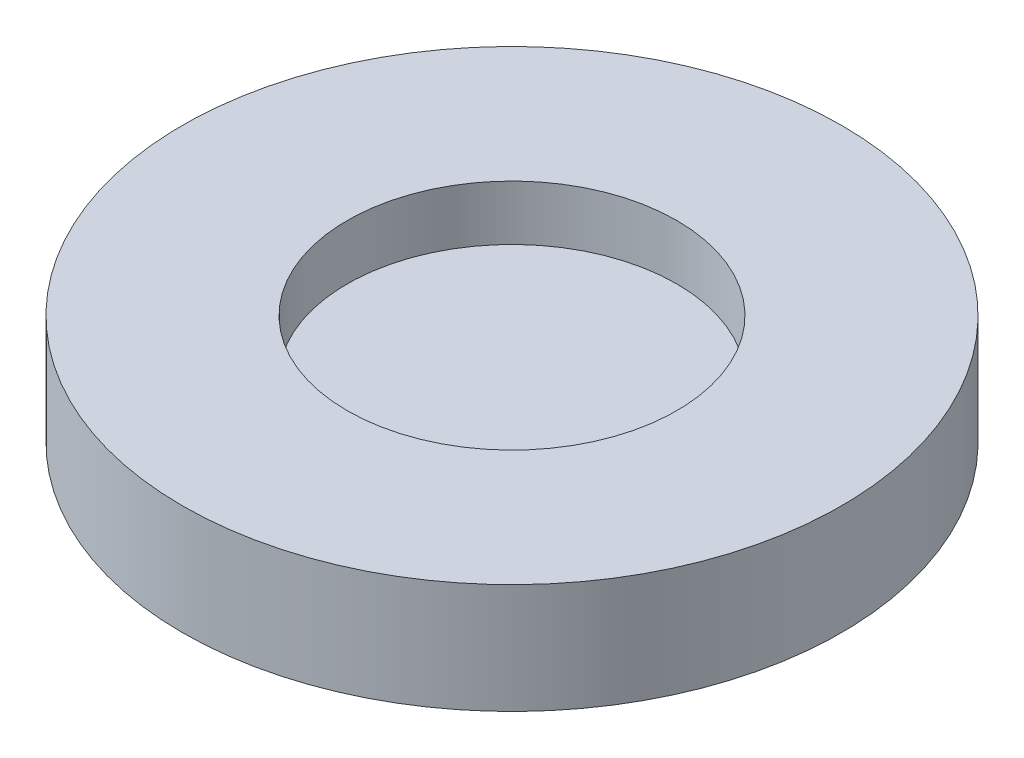
from build123d import *

# Parameters (mm, degrees)
ESQUISSE2_R             = 75
BOSS_EXTRU_1_DEPTH      = 25
ESQUISSE3_R             = 37.5
ENL_V_MAT_EXTRU_1_DEPTH = 12.5


with BuildPart() as part:
    # Esquisse2 → Boss.-Extru.1 (new body)
    with BuildSketch(Plane(origin=(0, 0, 0), x_dir=(1, 0, 0), z_dir=(0, 1, 0))):
        with Locations(Location((0, 0, 0), (0, 0, 270))):
            Circle(ESQUISSE2_R)
    extrude(amount=BOSS_EXTRU_1_DEPTH)

    # Esquisse3 → Enlèv. mat.-Extru.1 (cut)
    with BuildSketch(Plane(origin=(0, 25, 0), x_dir=(1, 0, 0), z_dir=(0, 1, 0))):
        with Locations(Location((0, 0, 0), (0, 0, 270))):
            Circle(ESQUISSE3_R)
    extrude(amount=-ENL_V_MAT_EXTRU_1_DEPTH, mode=Mode.SUBTRACT)


solid = part.part
